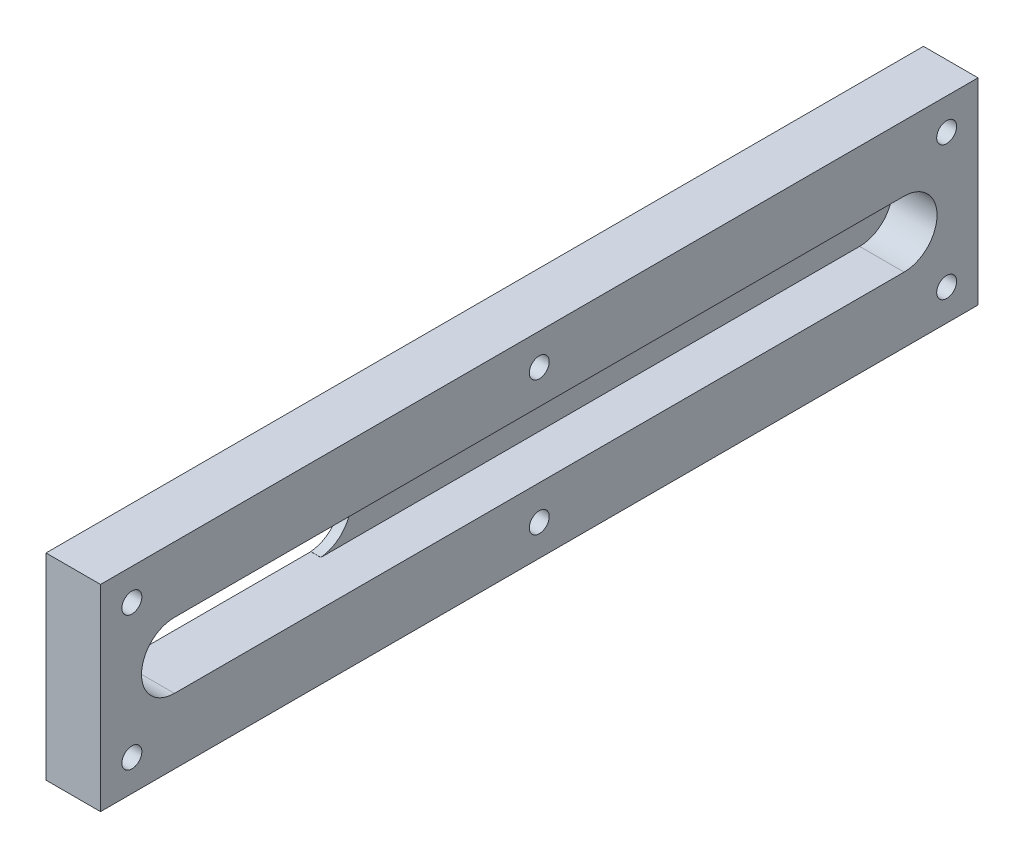
from build123d import *

# Parameters (mm, degrees)
SKETCH1_W              = 177.8
SKETCH1_H              = 39.878
BOSS_EXTRUDE1_DEPTH    = 11.049
F_10_32_TAPPED_HOLE1_D = 4.0386
BOSS_EXTRUDE2_DEPTH    = 2.032


with BuildPart() as part:
    # Sketch1 → Boss-Extrude1 (new body)
    with BuildSketch(Plane(origin=(0, 0, 0), x_dir=(0, 0, -1), z_dir=(1, 0, 0))):
        Rectangle(SKETCH1_W, SKETCH1_H)
        with BuildLine():
            Line((-73.9252522, 6.6675), (73.9252522, 6.6675))
            ThreePointArc((73.9252522, 6.6675), (80.5927522, 0), (73.9252522, -6.6675))
            Line((73.9252522, -6.6675), (-73.9252522, -6.6675))
            ThreePointArc((-73.9252522, -6.6675), (-80.5927522, 0), (-73.9252522, 6.6675))
        make_face(mode=Mode.SUBTRACT)
    extrude(amount=BOSS_EXTRUDE1_DEPTH)

    # #10-32 Tapped Hole1 (through all)
    with Locations(Plane(origin=(11.049, 0, 0), x_dir=(0, 0, -1), z_dir=(1, 0, 0))):
        with Locations((-82.55, 13.589), (-82.55, -13.589), (0, -13.589), (82.55, -13.589), (82.55, 13.589), (0, 13.589)):
            Hole(F_10_32_TAPPED_HOLE1_D / 2)

    # Sketch5 → Boss-Extrude2 (add)
    with BuildSketch(Plane.ZY):
        with BuildLine():
            Line((35.243819624, 6.6675), (35.243819624, 6.6421))
            ThreePointArc((35.243819624, 6.6421), (29.1577522, 0), (35.243819624, -6.6421))
            Line((35.243819624, -6.6421), (35.243819624, -6.6675))
            Line((35.243819624, -6.6675), (-73.9252522, -6.6675))
            ThreePointArc((-73.9252522, -6.6675), (-80.5927522, 0), (-73.9252522, 6.6675))
            Line((-73.9252522, 6.6675), (35.243819624, 6.6675))
        make_face()
    extrude(amount=-BOSS_EXTRUDE2_DEPTH)


solid = part.part
